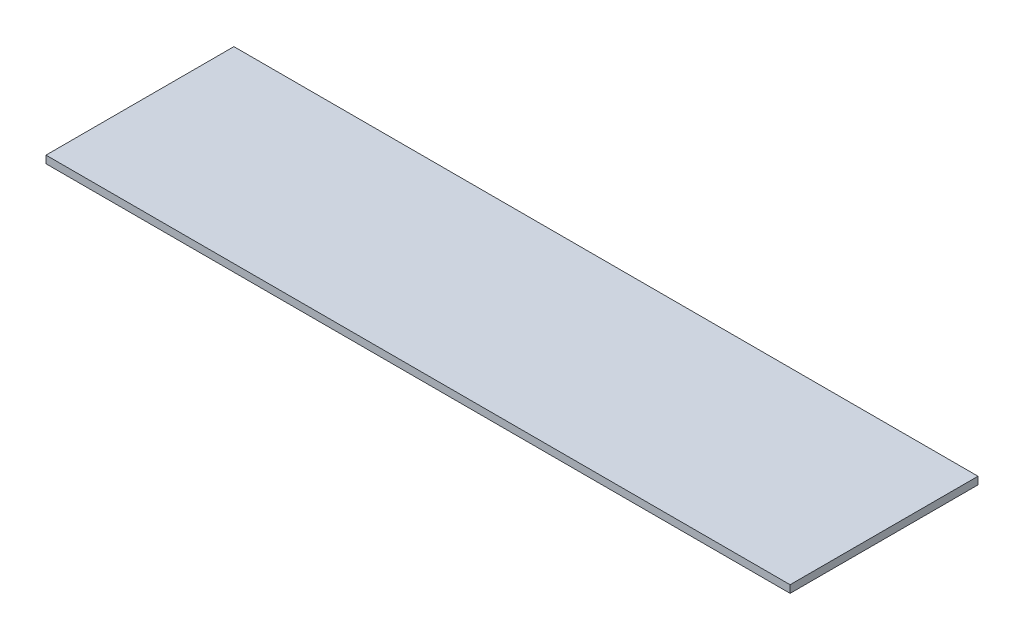
from build123d import *

# Parameters (mm, degrees)
SKETCH_1_W      = 990
SKETCH_1_H      = 250
EXTRUDE_1_DEPTH = 10


with BuildPart() as part:
    # Эскиз1 → Бобышка-Вытянуть1 (new body)
    with BuildSketch(Plane(origin=(0, 0, 0), x_dir=(1, 0, 0), z_dir=(0, 1, 0))):
        with Locations((495, 125)):
            Rectangle(SKETCH_1_W, SKETCH_1_H)
    extrude(amount=EXTRUDE_1_DEPTH)


solid = part.part
